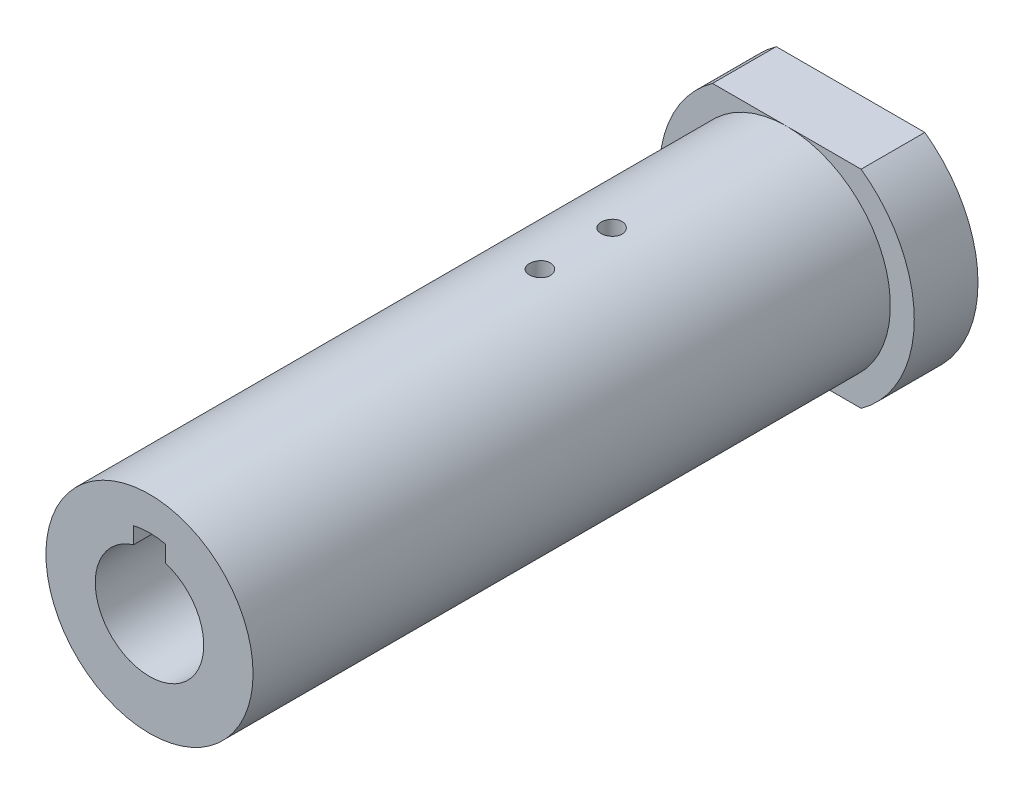
from build123d import *

# Parameters (mm, degrees)
SKETCH1_R           = 20.6375
SKETCH1_R_2         = 15.875
BOSS_EXTRUDE1_DEPTH = 76.2
SKETCH2_R           = 20.6375
SKETCH2_R_2         = 13.9954
BOSS_EXTRUDE2_DEPTH = 63.5
BOSS_EXTRUDE3_DEPTH = 12.7
BOSS_EXTRUDE4_START = -63.5
BOSS_EXTRUDE4_DEPTH = 63.5
SKETCH5_R           = 2.0828
CUT_EXTRUDE1_DEPTH  = 13.208


with BuildPart() as part:
    # Sketch1 → Boss-Extrude1 (new body)
    with BuildSketch(Plane.XY):
        Circle(SKETCH1_R)
        Circle(SKETCH1_R_2, mode=Mode.SUBTRACT)
    extrude(amount=BOSS_EXTRUDE1_DEPTH)

    # Sketch2 → Boss-Extrude2 (add)
    with BuildSketch(Plane.XY.offset(76.2)):
        Circle(SKETCH2_R)
        Circle(SKETCH2_R_2, mode=Mode.SUBTRACT)
    extrude(amount=BOSS_EXTRUDE2_DEPTH)

    # Sketch3 → Boss-Extrude3 (add)
    with BuildSketch(Plane.XY):
        with BuildLine():
            ThreePointArc((14.807214247, -20.6375), (25.4, 0), (14.807214247, 20.6375))
            Line((14.807214247, 20.6375), (0, 20.6375))
            ThreePointArc((0, 20.6375), (20.6375, 3.1e-08), (6.2e-08, -20.6375))
            Line((6.2e-08, -20.6375), (14.807214247, -20.6375))
        make_face()
        with BuildLine():
            ThreePointArc((6.2e-08, -20.6375), (-20.6375, -3.1e-08), (0, 20.6375))
            Line((0, 20.6375), (-14.807214247, 20.6375))
            ThreePointArc((-14.807214247, 20.6375), (-25.4, 0), (-14.807214247, -20.6375))
            Line((-14.807214247, -20.6375), (6.2e-08, -20.6375))
        make_face()
    extrude(amount=BOSS_EXTRUDE3_DEPTH)

    # Sketch4 → Boss-Extrude4 (add)
    with BuildSketch(Plane.XY.offset(139.7).offset(BOSS_EXTRUDE4_START)):
        with BuildLine():
            ThreePointArc((10.8077, 0), (-6.422302227, -8.692549304), (-3.175, 10.330815761))
            Line((-3.175, 10.330815761), (-3.175, 13.630502418))
            ThreePointArc((-3.175, 13.630502418), (-8.701604052, -10.961446441), (13.9954, 0))
            ThreePointArc((13.9954, 0), (10.961446441, 8.701604052), (3.175, 13.630502418))
            Line((3.175, 13.630502418), (3.175, 10.330815761))
            ThreePointArc((3.175, 10.330815761), (8.692549304, 6.422302227), (10.8077, 0))
        make_face()
    extrude(amount=BOSS_EXTRUDE4_DEPTH)

    # Sketch5 → Cut-Extrude1 (cut)
    with BuildSketch(Plane(origin=(0, 20.6375, 0), x_dir=(1, 0, 0), z_dir=(0, 1, 0))):
        with Locations((0, -47.625)):
            Circle(SKETCH5_R)
        with Locations((0, -61.9125)):
            Circle(SKETCH5_R)
    extrude(amount=-CUT_EXTRUDE1_DEPTH, mode=Mode.SUBTRACT)


solid = part.part
